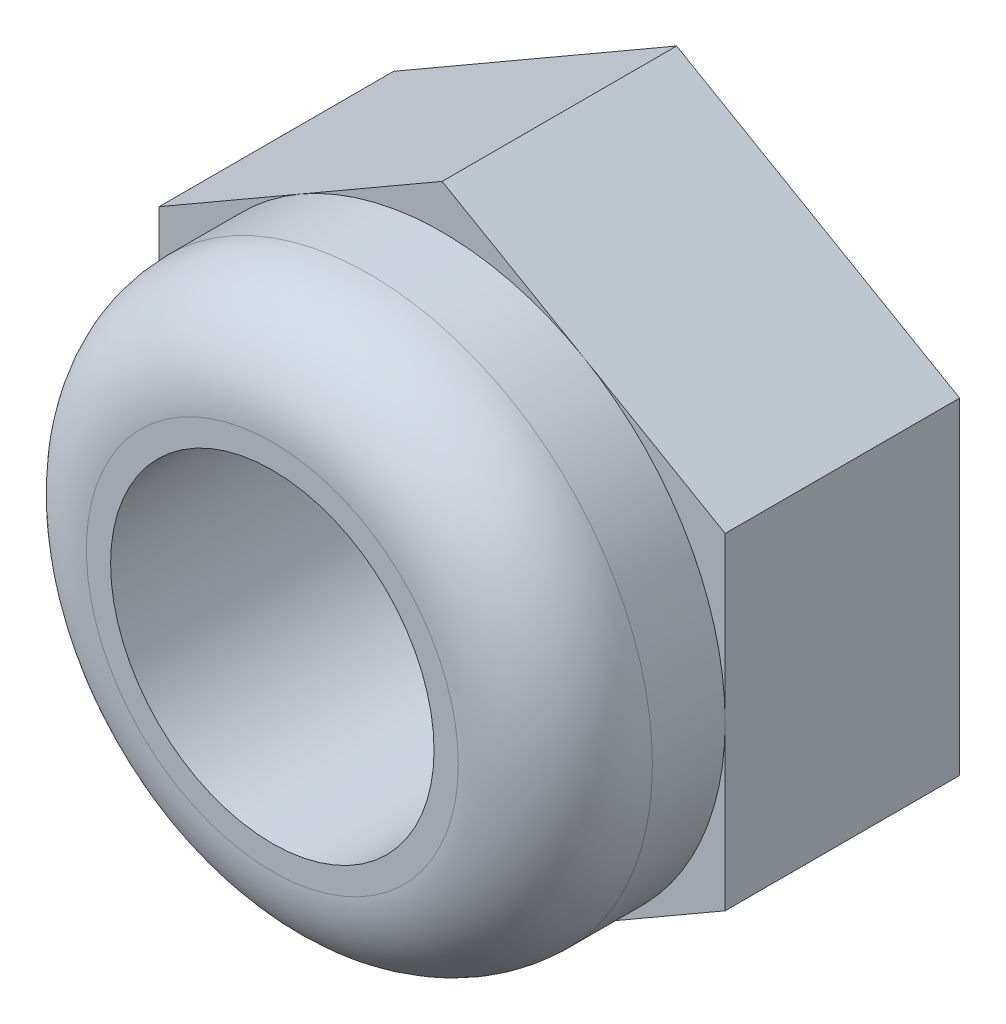
from build123d import *

# Parameters (mm, degrees)
EXTRUDE_1_DEPTH     = 2.9
SKETCH_2_R          = 3.5
EXTRUDE_2_DEPTH     = 2.1
SKETCH_3_R          = 2
CUT_EXTRUDE_1_DEPTH = 8.320063752
FILLET_1_R          = 1.2


with BuildPart() as part:
    # 草图1 → 凸台-拉伸1 (new body)
    with BuildSketch(Plane.XY):
        Polygon((3.5, -2.020725942), (3.5, 2.020725942), (0, 4.041451884), (-3.5, 2.020725942), (-3.5, -2.020725942), (0, -4.041451884), align=None)
    extrude(amount=EXTRUDE_1_DEPTH)

    # 草图2 → 凸台-拉伸2 (add)
    with BuildSketch(Plane.XY.offset(2.9)):
        Circle(SKETCH_2_R)
    extrude(amount=EXTRUDE_2_DEPTH)

    # 草图3 → 切除-拉伸1 (cut, through all)
    with BuildSketch(Plane.XY.offset(5)):
        Circle(SKETCH_3_R)
    extrude(amount=-CUT_EXTRUDE_1_DEPTH, mode=Mode.SUBTRACT)

    # 圆角1
    fillet_1_edges = [part.edges().sort_by_distance(p)[0] for p in [
        (-3.5, 0, 5),
    ]]
    fillet(fillet_1_edges, radius=FILLET_1_R)


solid = part.part
